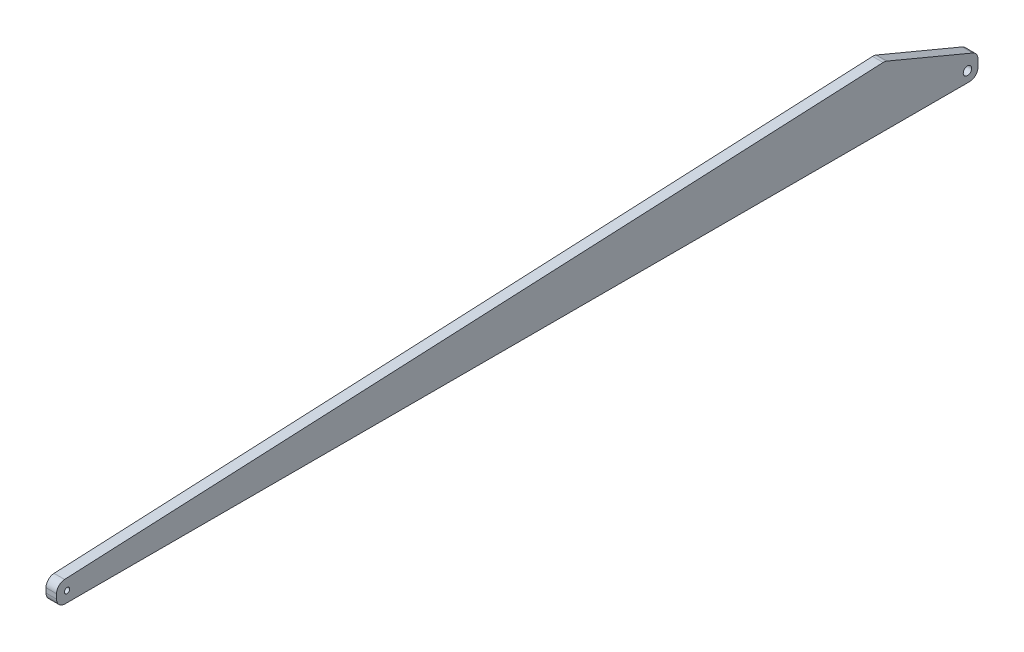
from build123d import *

# Parameters (mm, degrees)
SKETCH3_R           = 1.6002
SKETCH3_R_2         = 2.5527
BOSS_EXTRUDE1_DEPTH = 6.35
FILLET1_R           = 5.08


with BuildPart() as part:
    # Sketch3 → Boss-Extrude1 (new body)
    with BuildSketch(Plane(origin=(0, 0, 0), x_dir=(0, 0, -1), z_dir=(1, 0, 0))):
        Polygon((-265.049, 0), (265.049, 0), (277.749, 0), (277.749, 12.7), (221.687563823, 36.153126397), (-277.749, 12.7), (-277.749, 0), align=None)
        with Locations((-271.399, 6.35)):
            Circle(SKETCH3_R, mode=Mode.SUBTRACT)
        with Locations((271.399, 6.35)):
            Circle(SKETCH3_R_2, mode=Mode.SUBTRACT)
    extrude(amount=BOSS_EXTRUDE1_DEPTH)

    # Fillet1
    fillet1_edges = [part.edges().sort_by_distance(p)[0] for p in [
        (3.175, 0, 277.749),
        (3.175, 12.7, 277.749),
        (3.175, 36.153126397, -221.687563823),
        (3.175, 12.7, -277.749),
        (3.175, 0, -277.749),
    ]]
    fillet(fillet1_edges, radius=FILLET1_R)


solid = part.part
